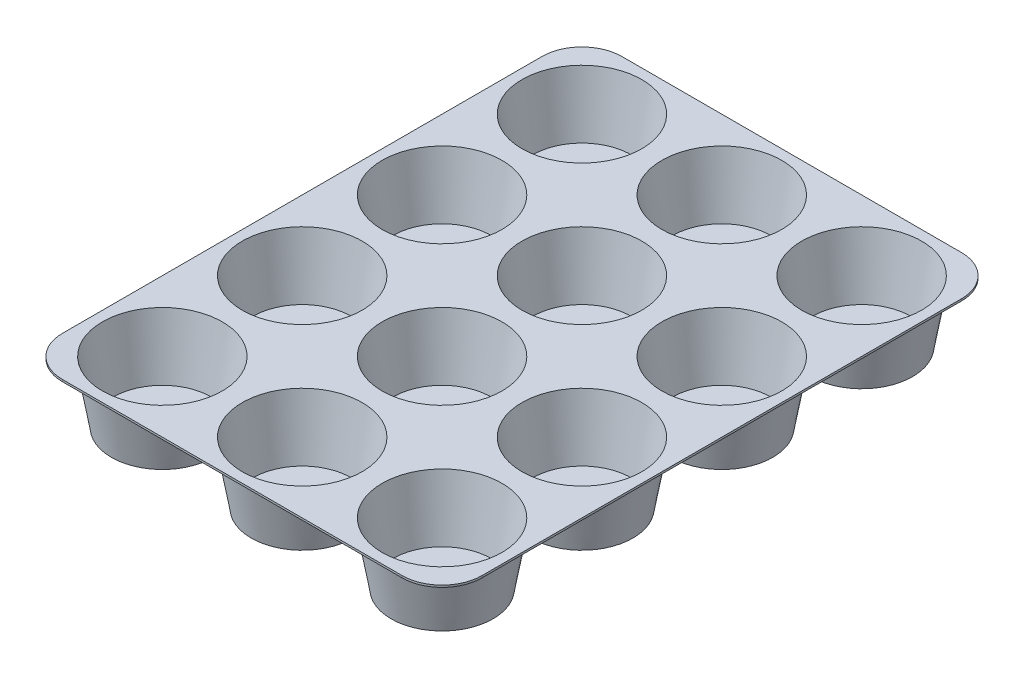
from build123d import *

# Parameters (mm, degrees)
SKETCH1_W                  = 266.7
SKETCH1_H                  = 355.6
BOSS_EXTRUDE1_DEPTH        = 1.27
SKETCH2_R                  = 39.37
BOSS_EXTRUDE2_DEPTH        = 39.37
BOSS_EXTRUDE2_DRAFT        = -10
SKETCH3_R                  = 38.1
CUT_EXTRUDE1_DEPTH         = 38.1
CUT_EXTRUDE1_DRAFT         = -10
LPATTERN1_COPY_1_SKETCH_R  = 39.37
LPATTERN1_COPY_1_DEPTH     = 39.37
LPATTERN1_COPY_1_DRAFT     = -10
LPATTERN1_COPY_2_SKETCH_R  = 39.37
LPATTERN1_COPY_2_DEPTH     = 39.37
LPATTERN1_COPY_2_DRAFT     = -10
LPATTERN1_COPY_3_SKETCH_R  = 39.37
LPATTERN1_COPY_3_DEPTH     = 39.37
LPATTERN1_COPY_3_DRAFT     = -10
LPATTERN1_COPY_4_SKETCH_R  = 39.37
LPATTERN1_COPY_4_DEPTH     = 39.37
LPATTERN1_COPY_4_DRAFT     = -10
LPATTERN1_COPY_5_SKETCH_R  = 39.37
LPATTERN1_COPY_5_DEPTH     = 39.37
LPATTERN1_COPY_5_DRAFT     = -10
LPATTERN1_COPY_6_SKETCH_R  = 39.37
LPATTERN1_COPY_6_DEPTH     = 39.37
LPATTERN1_COPY_6_DRAFT     = -10
LPATTERN1_COPY_7_SKETCH_R  = 39.37
LPATTERN1_COPY_7_DEPTH     = 39.37
LPATTERN1_COPY_7_DRAFT     = -10
LPATTERN1_COPY_8_SKETCH_R  = 39.37
LPATTERN1_COPY_8_DEPTH     = 39.37
LPATTERN1_COPY_8_DRAFT     = -10
LPATTERN1_COPY_9_SKETCH_R  = 39.37
LPATTERN1_COPY_9_DEPTH     = 39.37
LPATTERN1_COPY_9_DRAFT     = -10
LPATTERN1_COPY_10_SKETCH_R = 39.37
LPATTERN1_COPY_10_DEPTH    = 39.37
LPATTERN1_COPY_10_DRAFT    = -10
LPATTERN1_COPY_11_SKETCH_R = 39.37
LPATTERN1_COPY_11_DEPTH    = 39.37
LPATTERN1_COPY_11_DRAFT    = -10
LPATTERN1_COPY_12_SKETCH_R = 38.1
LPATTERN1_COPY_12_DEPTH    = 38.1
LPATTERN1_COPY_12_DRAFT    = -10
LPATTERN1_COPY_13_SKETCH_R = 38.1
LPATTERN1_COPY_13_DEPTH    = 38.1
LPATTERN1_COPY_13_DRAFT    = -10
LPATTERN1_COPY_14_SKETCH_R = 38.1
LPATTERN1_COPY_14_DEPTH    = 38.1
LPATTERN1_COPY_14_DRAFT    = -10
LPATTERN1_COPY_15_SKETCH_R = 38.1
LPATTERN1_COPY_15_DEPTH    = 38.1
LPATTERN1_COPY_15_DRAFT    = -10
LPATTERN1_COPY_16_SKETCH_R = 38.1
LPATTERN1_COPY_16_DEPTH    = 38.1
LPATTERN1_COPY_16_DRAFT    = -10
LPATTERN1_COPY_17_SKETCH_R = 38.1
LPATTERN1_COPY_17_DEPTH    = 38.1
LPATTERN1_COPY_17_DRAFT    = -10
LPATTERN1_COPY_18_SKETCH_R = 38.1
LPATTERN1_COPY_18_DEPTH    = 38.1
LPATTERN1_COPY_18_DRAFT    = -10
LPATTERN1_COPY_19_SKETCH_R = 38.1
LPATTERN1_COPY_19_DEPTH    = 38.1
LPATTERN1_COPY_19_DRAFT    = -10
LPATTERN1_COPY_20_SKETCH_R = 38.1
LPATTERN1_COPY_20_DEPTH    = 38.1
LPATTERN1_COPY_20_DRAFT    = -10
LPATTERN1_COPY_21_SKETCH_R = 38.1
LPATTERN1_COPY_21_DEPTH    = 38.1
LPATTERN1_COPY_21_DRAFT    = -10
LPATTERN1_COPY_22_SKETCH_R = 38.1
LPATTERN1_COPY_22_DEPTH    = 38.1
LPATTERN1_COPY_22_DRAFT    = -10
FILLET1_R                  = 25.4


with BuildPart() as part:
    # Sketch1 → Boss-Extrude1 (new body)
    with BuildSketch(Plane(origin=(0, 0, 0), x_dir=(1, 0, 0), z_dir=(0, 1, 0))):
        Rectangle(SKETCH1_W, SKETCH1_H)
    extrude(amount=BOSS_EXTRUDE1_DEPTH)


with BuildPart() as boss_extrude2_tool:
    # Sketch2 → Boss-Extrude2 (with draft: the straight prism first)
    with BuildSketch(Plane(origin=(0, 1.27, 0), x_dir=(1, 0, 0), z_dir=(0, 1, 0))):
        with Locations((-88.9, 133.35)):
            Circle(SKETCH2_R)
    extrude(amount=-BOSS_EXTRUDE2_DEPTH)
    # Boss-Extrude2: the draft: its side faces are tilted about the plane it starts from
    boss_extrude2_sides = [boss_extrude2_tool.faces().sort_by_distance(p)[0] for p in [
        (-128.27, -18.415, -133.35),
    ]]
    draft(boss_extrude2_sides, Plane(origin=(0, 1.27, 0), x_dir=(1, 0, 0), z_dir=(0, 1, 0)), BOSS_EXTRUDE2_DRAFT)


with BuildPart() as part_1:
    add(part.part)

    # Boss-Extrude2: add boss_extrude2_tool
    add(boss_extrude2_tool.part)


with BuildPart() as cut_extrude1_tool:
    # Sketch3 → Cut-Extrude1 (with draft: the straight prism first)
    with BuildSketch(Plane(origin=(0, 1.27, 0), x_dir=(1, 0, 0), z_dir=(0, 1, 0))):
        with Locations((-88.9, 133.35)):
            Circle(SKETCH3_R)
    extrude(amount=-CUT_EXTRUDE1_DEPTH)
    # Cut-Extrude1: the draft: its side faces are tilted about the plane it starts from
    cut_extrude1_sides = [cut_extrude1_tool.faces().sort_by_distance(p)[0] for p in [
        (-127, -17.78, -133.35),
    ]]
    draft(cut_extrude1_sides, Plane(origin=(0, 1.27, 0), x_dir=(1, 0, 0), z_dir=(0, 1, 0)), CUT_EXTRUDE1_DRAFT)


with BuildPart() as part_2:
    add(part_1.part)

    # Cut-Extrude1: cut by cut_extrude1_tool
    add(cut_extrude1_tool.part, mode=Mode.SUBTRACT)


with BuildPart() as lpattern1_copy_1_tool:
    # LPattern1 copy 1 sketch → LPattern1 copy 1 (with draft: the straight prism first)
    with BuildSketch(Plane(origin=(0, 1.27, 88.9), x_dir=(1, 0, 0), z_dir=(0, 1, 0))):
        with Locations((-88.9, 133.35)):
            Circle(LPATTERN1_COPY_1_SKETCH_R)
    extrude(amount=-LPATTERN1_COPY_1_DEPTH)
    # LPattern1 copy 1: the draft: its side faces are tilted about the plane it starts from
    lpattern1_copy_1_sides = [lpattern1_copy_1_tool.faces().sort_by_distance(p)[0] for p in [
        (-128.27, -18.415, -44.45),
    ]]
    draft(lpattern1_copy_1_sides, Plane(origin=(0, 1.27, 88.9), x_dir=(1, 0, 0), z_dir=(0, 1, 0)), LPATTERN1_COPY_1_DRAFT)


with BuildPart() as part_3:
    add(part_2.part)

    # LPattern1 copy 1: add lpattern1_copy_1_tool
    add(lpattern1_copy_1_tool.part)


with BuildPart() as lpattern1_copy_2_tool:
    # LPattern1 copy 2 sketch → LPattern1 copy 2 (with draft: the straight prism first)
    with BuildSketch(Plane(origin=(0, 1.27, 177.8), x_dir=(1, 0, 0), z_dir=(0, 1, 0))):
        with Locations((-88.9, 133.35)):
            Circle(LPATTERN1_COPY_2_SKETCH_R)
    extrude(amount=-LPATTERN1_COPY_2_DEPTH)
    # LPattern1 copy 2: the draft: its side faces are tilted about the plane it starts from
    lpattern1_copy_2_sides = [lpattern1_copy_2_tool.faces().sort_by_distance(p)[0] for p in [
        (-128.27, -18.415, 44.45),
    ]]
    draft(lpattern1_copy_2_sides, Plane(origin=(0, 1.27, 177.8), x_dir=(1, 0, 0), z_dir=(0, 1, 0)), LPATTERN1_COPY_2_DRAFT)


with BuildPart() as part_4:
    add(part_3.part)

    # LPattern1 copy 2: add lpattern1_copy_2_tool
    add(lpattern1_copy_2_tool.part)


with BuildPart() as lpattern1_copy_3_tool:
    # LPattern1 copy 3 sketch → LPattern1 copy 3 (with draft: the straight prism first)
    with BuildSketch(Plane(origin=(0, 1.27, 266.7), x_dir=(1, 0, 0), z_dir=(0, 1, 0))):
        with Locations((-88.9, 133.35)):
            Circle(LPATTERN1_COPY_3_SKETCH_R)
    extrude(amount=-LPATTERN1_COPY_3_DEPTH)
    # LPattern1 copy 3: the draft: its side faces are tilted about the plane it starts from
    lpattern1_copy_3_sides = [lpattern1_copy_3_tool.faces().sort_by_distance(p)[0] for p in [
        (-128.27, -18.415, 133.35),
    ]]
    draft(lpattern1_copy_3_sides, Plane(origin=(0, 1.27, 266.7), x_dir=(1, 0, 0), z_dir=(0, 1, 0)), LPATTERN1_COPY_3_DRAFT)


with BuildPart() as part_5:
    add(part_4.part)

    # LPattern1 copy 3: add lpattern1_copy_3_tool
    add(lpattern1_copy_3_tool.part)


with BuildPart() as lpattern1_copy_4_tool:
    # LPattern1 copy 4 sketch → LPattern1 copy 4 (with draft: the straight prism first)
    with BuildSketch(Plane(origin=(88.9, 1.27, 0), x_dir=(1, 0, 0), z_dir=(0, 1, 0))):
        with Locations((-88.9, 133.35)):
            Circle(LPATTERN1_COPY_4_SKETCH_R)
    extrude(amount=-LPATTERN1_COPY_4_DEPTH)
    # LPattern1 copy 4: the draft: its side faces are tilted about the plane it starts from
    lpattern1_copy_4_sides = [lpattern1_copy_4_tool.faces().sort_by_distance(p)[0] for p in [
        (-39.37, -18.415, -133.35),
    ]]
    draft(lpattern1_copy_4_sides, Plane(origin=(88.9, 1.27, 0), x_dir=(1, 0, 0), z_dir=(0, 1, 0)), LPATTERN1_COPY_4_DRAFT)


with BuildPart() as part_6:
    add(part_5.part)

    # LPattern1 copy 4: add lpattern1_copy_4_tool
    add(lpattern1_copy_4_tool.part)


with BuildPart() as lpattern1_copy_5_tool:
    # LPattern1 copy 5 sketch → LPattern1 copy 5 (with draft: the straight prism first)
    with BuildSketch(Plane(origin=(88.9, 1.27, 88.9), x_dir=(1, 0, 0), z_dir=(0, 1, 0))):
        with Locations((-88.9, 133.35)):
            Circle(LPATTERN1_COPY_5_SKETCH_R)
    extrude(amount=-LPATTERN1_COPY_5_DEPTH)
    # LPattern1 copy 5: the draft: its side faces are tilted about the plane it starts from
    lpattern1_copy_5_sides = [lpattern1_copy_5_tool.faces().sort_by_distance(p)[0] for p in [
        (-39.37, -18.415, -44.45),
    ]]
    draft(lpattern1_copy_5_sides, Plane(origin=(88.9, 1.27, 88.9), x_dir=(1, 0, 0), z_dir=(0, 1, 0)), LPATTERN1_COPY_5_DRAFT)


with BuildPart() as part_7:
    add(part_6.part)

    # LPattern1 copy 5: add lpattern1_copy_5_tool
    add(lpattern1_copy_5_tool.part)


with BuildPart() as lpattern1_copy_6_tool:
    # LPattern1 copy 6 sketch → LPattern1 copy 6 (with draft: the straight prism first)
    with BuildSketch(Plane(origin=(88.9, 1.27, 177.8), x_dir=(1, 0, 0), z_dir=(0, 1, 0))):
        with Locations((-88.9, 133.35)):
            Circle(LPATTERN1_COPY_6_SKETCH_R)
    extrude(amount=-LPATTERN1_COPY_6_DEPTH)
    # LPattern1 copy 6: the draft: its side faces are tilted about the plane it starts from
    lpattern1_copy_6_sides = [lpattern1_copy_6_tool.faces().sort_by_distance(p)[0] for p in [
        (-39.37, -18.415, 44.45),
    ]]
    draft(lpattern1_copy_6_sides, Plane(origin=(88.9, 1.27, 177.8), x_dir=(1, 0, 0), z_dir=(0, 1, 0)), LPATTERN1_COPY_6_DRAFT)


with BuildPart() as part_8:
    add(part_7.part)

    # LPattern1 copy 6: add lpattern1_copy_6_tool
    add(lpattern1_copy_6_tool.part)


with BuildPart() as lpattern1_copy_7_tool:
    # LPattern1 copy 7 sketch → LPattern1 copy 7 (with draft: the straight prism first)
    with BuildSketch(Plane(origin=(88.9, 1.27, 266.7), x_dir=(1, 0, 0), z_dir=(0, 1, 0))):
        with Locations((-88.9, 133.35)):
            Circle(LPATTERN1_COPY_7_SKETCH_R)
    extrude(amount=-LPATTERN1_COPY_7_DEPTH)
    # LPattern1 copy 7: the draft: its side faces are tilted about the plane it starts from
    lpattern1_copy_7_sides = [lpattern1_copy_7_tool.faces().sort_by_distance(p)[0] for p in [
        (-39.37, -18.415, 133.35),
    ]]
    draft(lpattern1_copy_7_sides, Plane(origin=(88.9, 1.27, 266.7), x_dir=(1, 0, 0), z_dir=(0, 1, 0)), LPATTERN1_COPY_7_DRAFT)


with BuildPart() as part_9:
    add(part_8.part)

    # LPattern1 copy 7: add lpattern1_copy_7_tool
    add(lpattern1_copy_7_tool.part)


with BuildPart() as lpattern1_copy_8_tool:
    # LPattern1 copy 8 sketch → LPattern1 copy 8 (with draft: the straight prism first)
    with BuildSketch(Plane(origin=(177.8, 1.27, 0), x_dir=(1, 0, 0), z_dir=(0, 1, 0))):
        with Locations((-88.9, 133.35)):
            Circle(LPATTERN1_COPY_8_SKETCH_R)
    extrude(amount=-LPATTERN1_COPY_8_DEPTH)
    # LPattern1 copy 8: the draft: its side faces are tilted about the plane it starts from
    lpattern1_copy_8_sides = [lpattern1_copy_8_tool.faces().sort_by_distance(p)[0] for p in [
        (49.53, -18.415, -133.35),
    ]]
    draft(lpattern1_copy_8_sides, Plane(origin=(177.8, 1.27, 0), x_dir=(1, 0, 0), z_dir=(0, 1, 0)), LPATTERN1_COPY_8_DRAFT)


with BuildPart() as part_10:
    add(part_9.part)

    # LPattern1 copy 8: add lpattern1_copy_8_tool
    add(lpattern1_copy_8_tool.part)


with BuildPart() as lpattern1_copy_9_tool:
    # LPattern1 copy 9 sketch → LPattern1 copy 9 (with draft: the straight prism first)
    with BuildSketch(Plane(origin=(177.8, 1.27, 88.9), x_dir=(1, 0, 0), z_dir=(0, 1, 0))):
        with Locations((-88.9, 133.35)):
            Circle(LPATTERN1_COPY_9_SKETCH_R)
    extrude(amount=-LPATTERN1_COPY_9_DEPTH)
    # LPattern1 copy 9: the draft: its side faces are tilted about the plane it starts from
    lpattern1_copy_9_sides = [lpattern1_copy_9_tool.faces().sort_by_distance(p)[0] for p in [
        (49.53, -18.415, -44.45),
    ]]
    draft(lpattern1_copy_9_sides, Plane(origin=(177.8, 1.27, 88.9), x_dir=(1, 0, 0), z_dir=(0, 1, 0)), LPATTERN1_COPY_9_DRAFT)


with BuildPart() as part_11:
    add(part_10.part)

    # LPattern1 copy 9: add lpattern1_copy_9_tool
    add(lpattern1_copy_9_tool.part)


with BuildPart() as lpattern1_copy_10_tool:
    # LPattern1 copy 10 sketch → LPattern1 copy 10 (with draft: the straight prism first)
    with BuildSketch(Plane(origin=(177.8, 1.27, 177.8), x_dir=(1, 0, 0), z_dir=(0, 1, 0))):
        with Locations((-88.9, 133.35)):
            Circle(LPATTERN1_COPY_10_SKETCH_R)
    extrude(amount=-LPATTERN1_COPY_10_DEPTH)
    # LPattern1 copy 10: the draft: its side faces are tilted about the plane it starts from
    lpattern1_copy_10_sides = [lpattern1_copy_10_tool.faces().sort_by_distance(p)[0] for p in [
        (49.53, -18.415, 44.45),
    ]]
    draft(lpattern1_copy_10_sides, Plane(origin=(177.8, 1.27, 177.8), x_dir=(1, 0, 0), z_dir=(0, 1, 0)), LPATTERN1_COPY_10_DRAFT)


with BuildPart() as part_12:
    add(part_11.part)

    # LPattern1 copy 10: add lpattern1_copy_10_tool
    add(lpattern1_copy_10_tool.part)


with BuildPart() as lpattern1_copy_11_tool:
    # LPattern1 copy 11 sketch → LPattern1 copy 11 (with draft: the straight prism first)
    with BuildSketch(Plane(origin=(177.8, 1.27, 266.7), x_dir=(1, 0, 0), z_dir=(0, 1, 0))):
        with Locations((-88.9, 133.35)):
            Circle(LPATTERN1_COPY_11_SKETCH_R)
    extrude(amount=-LPATTERN1_COPY_11_DEPTH)
    # LPattern1 copy 11: the draft: its side faces are tilted about the plane it starts from
    lpattern1_copy_11_sides = [lpattern1_copy_11_tool.faces().sort_by_distance(p)[0] for p in [
        (49.53, -18.415, 133.35),
    ]]
    draft(lpattern1_copy_11_sides, Plane(origin=(177.8, 1.27, 266.7), x_dir=(1, 0, 0), z_dir=(0, 1, 0)), LPATTERN1_COPY_11_DRAFT)


with BuildPart() as part_13:
    add(part_12.part)

    # LPattern1 copy 11: add lpattern1_copy_11_tool
    add(lpattern1_copy_11_tool.part)


with BuildPart() as lpattern1_copy_12_tool:
    # LPattern1 copy 12 sketch → LPattern1 copy 12 (with draft: the straight prism first)
    with BuildSketch(Plane(origin=(0, 1.27, 88.9), x_dir=(1, 0, 0), z_dir=(0, 1, 0))):
        with Locations((-88.9, 133.35)):
            Circle(LPATTERN1_COPY_12_SKETCH_R)
    extrude(amount=-LPATTERN1_COPY_12_DEPTH)
    # LPattern1 copy 12: the draft: its side faces are tilted about the plane it starts from
    lpattern1_copy_12_sides = [lpattern1_copy_12_tool.faces().sort_by_distance(p)[0] for p in [
        (-127, -17.78, -44.45),
    ]]
    draft(lpattern1_copy_12_sides, Plane(origin=(0, 1.27, 88.9), x_dir=(1, 0, 0), z_dir=(0, 1, 0)), LPATTERN1_COPY_12_DRAFT)


with BuildPart() as part_14:
    add(part_13.part)

    # LPattern1 copy 12: cut by lpattern1_copy_12_tool
    add(lpattern1_copy_12_tool.part, mode=Mode.SUBTRACT)


with BuildPart() as lpattern1_copy_13_tool:
    # LPattern1 copy 13 sketch → LPattern1 copy 13 (with draft: the straight prism first)
    with BuildSketch(Plane(origin=(0, 1.27, 177.8), x_dir=(1, 0, 0), z_dir=(0, 1, 0))):
        with Locations((-88.9, 133.35)):
            Circle(LPATTERN1_COPY_13_SKETCH_R)
    extrude(amount=-LPATTERN1_COPY_13_DEPTH)
    # LPattern1 copy 13: the draft: its side faces are tilted about the plane it starts from
    lpattern1_copy_13_sides = [lpattern1_copy_13_tool.faces().sort_by_distance(p)[0] for p in [
        (-127, -17.78, 44.45),
    ]]
    draft(lpattern1_copy_13_sides, Plane(origin=(0, 1.27, 177.8), x_dir=(1, 0, 0), z_dir=(0, 1, 0)), LPATTERN1_COPY_13_DRAFT)


with BuildPart() as part_15:
    add(part_14.part)

    # LPattern1 copy 13: cut by lpattern1_copy_13_tool
    add(lpattern1_copy_13_tool.part, mode=Mode.SUBTRACT)


with BuildPart() as lpattern1_copy_14_tool:
    # LPattern1 copy 14 sketch → LPattern1 copy 14 (with draft: the straight prism first)
    with BuildSketch(Plane(origin=(0, 1.27, 266.7), x_dir=(1, 0, 0), z_dir=(0, 1, 0))):
        with Locations((-88.9, 133.35)):
            Circle(LPATTERN1_COPY_14_SKETCH_R)
    extrude(amount=-LPATTERN1_COPY_14_DEPTH)
    # LPattern1 copy 14: the draft: its side faces are tilted about the plane it starts from
    lpattern1_copy_14_sides = [lpattern1_copy_14_tool.faces().sort_by_distance(p)[0] for p in [
        (-127, -17.78, 133.35),
    ]]
    draft(lpattern1_copy_14_sides, Plane(origin=(0, 1.27, 266.7), x_dir=(1, 0, 0), z_dir=(0, 1, 0)), LPATTERN1_COPY_14_DRAFT)


with BuildPart() as part_16:
    add(part_15.part)

    # LPattern1 copy 14: cut by lpattern1_copy_14_tool
    add(lpattern1_copy_14_tool.part, mode=Mode.SUBTRACT)


with BuildPart() as lpattern1_copy_15_tool:
    # LPattern1 copy 15 sketch → LPattern1 copy 15 (with draft: the straight prism first)
    with BuildSketch(Plane(origin=(88.9, 1.27, 0), x_dir=(1, 0, 0), z_dir=(0, 1, 0))):
        with Locations((-88.9, 133.35)):
            Circle(LPATTERN1_COPY_15_SKETCH_R)
    extrude(amount=-LPATTERN1_COPY_15_DEPTH)
    # LPattern1 copy 15: the draft: its side faces are tilted about the plane it starts from
    lpattern1_copy_15_sides = [lpattern1_copy_15_tool.faces().sort_by_distance(p)[0] for p in [
        (-38.1, -17.78, -133.35),
    ]]
    draft(lpattern1_copy_15_sides, Plane(origin=(88.9, 1.27, 0), x_dir=(1, 0, 0), z_dir=(0, 1, 0)), LPATTERN1_COPY_15_DRAFT)


with BuildPart() as part_17:
    add(part_16.part)

    # LPattern1 copy 15: cut by lpattern1_copy_15_tool
    add(lpattern1_copy_15_tool.part, mode=Mode.SUBTRACT)


with BuildPart() as lpattern1_copy_16_tool:
    # LPattern1 copy 16 sketch → LPattern1 copy 16 (with draft: the straight prism first)
    with BuildSketch(Plane(origin=(88.9, 1.27, 88.9), x_dir=(1, 0, 0), z_dir=(0, 1, 0))):
        with Locations((-88.9, 133.35)):
            Circle(LPATTERN1_COPY_16_SKETCH_R)
    extrude(amount=-LPATTERN1_COPY_16_DEPTH)
    # LPattern1 copy 16: the draft: its side faces are tilted about the plane it starts from
    lpattern1_copy_16_sides = [lpattern1_copy_16_tool.faces().sort_by_distance(p)[0] for p in [
        (-38.1, -17.78, -44.45),
    ]]
    draft(lpattern1_copy_16_sides, Plane(origin=(88.9, 1.27, 88.9), x_dir=(1, 0, 0), z_dir=(0, 1, 0)), LPATTERN1_COPY_16_DRAFT)


with BuildPart() as part_18:
    add(part_17.part)

    # LPattern1 copy 16: cut by lpattern1_copy_16_tool
    add(lpattern1_copy_16_tool.part, mode=Mode.SUBTRACT)


with BuildPart() as lpattern1_copy_17_tool:
    # LPattern1 copy 17 sketch → LPattern1 copy 17 (with draft: the straight prism first)
    with BuildSketch(Plane(origin=(88.9, 1.27, 177.8), x_dir=(1, 0, 0), z_dir=(0, 1, 0))):
        with Locations((-88.9, 133.35)):
            Circle(LPATTERN1_COPY_17_SKETCH_R)
    extrude(amount=-LPATTERN1_COPY_17_DEPTH)
    # LPattern1 copy 17: the draft: its side faces are tilted about the plane it starts from
    lpattern1_copy_17_sides = [lpattern1_copy_17_tool.faces().sort_by_distance(p)[0] for p in [
        (-38.1, -17.78, 44.45),
    ]]
    draft(lpattern1_copy_17_sides, Plane(origin=(88.9, 1.27, 177.8), x_dir=(1, 0, 0), z_dir=(0, 1, 0)), LPATTERN1_COPY_17_DRAFT)


with BuildPart() as part_19:
    add(part_18.part)

    # LPattern1 copy 17: cut by lpattern1_copy_17_tool
    add(lpattern1_copy_17_tool.part, mode=Mode.SUBTRACT)


with BuildPart() as lpattern1_copy_18_tool:
    # LPattern1 copy 18 sketch → LPattern1 copy 18 (with draft: the straight prism first)
    with BuildSketch(Plane(origin=(88.9, 1.27, 266.7), x_dir=(1, 0, 0), z_dir=(0, 1, 0))):
        with Locations((-88.9, 133.35)):
            Circle(LPATTERN1_COPY_18_SKETCH_R)
    extrude(amount=-LPATTERN1_COPY_18_DEPTH)
    # LPattern1 copy 18: the draft: its side faces are tilted about the plane it starts from
    lpattern1_copy_18_sides = [lpattern1_copy_18_tool.faces().sort_by_distance(p)[0] for p in [
        (-38.1, -17.78, 133.35),
    ]]
    draft(lpattern1_copy_18_sides, Plane(origin=(88.9, 1.27, 266.7), x_dir=(1, 0, 0), z_dir=(0, 1, 0)), LPATTERN1_COPY_18_DRAFT)


with BuildPart() as part_20:
    add(part_19.part)

    # LPattern1 copy 18: cut by lpattern1_copy_18_tool
    add(lpattern1_copy_18_tool.part, mode=Mode.SUBTRACT)


with BuildPart() as lpattern1_copy_19_tool:
    # LPattern1 copy 19 sketch → LPattern1 copy 19 (with draft: the straight prism first)
    with BuildSketch(Plane(origin=(177.8, 1.27, 0), x_dir=(1, 0, 0), z_dir=(0, 1, 0))):
        with Locations((-88.9, 133.35)):
            Circle(LPATTERN1_COPY_19_SKETCH_R)
    extrude(amount=-LPATTERN1_COPY_19_DEPTH)
    # LPattern1 copy 19: the draft: its side faces are tilted about the plane it starts from
    lpattern1_copy_19_sides = [lpattern1_copy_19_tool.faces().sort_by_distance(p)[0] for p in [
        (50.8, -17.78, -133.35),
    ]]
    draft(lpattern1_copy_19_sides, Plane(origin=(177.8, 1.27, 0), x_dir=(1, 0, 0), z_dir=(0, 1, 0)), LPATTERN1_COPY_19_DRAFT)


with BuildPart() as part_21:
    add(part_20.part)

    # LPattern1 copy 19: cut by lpattern1_copy_19_tool
    add(lpattern1_copy_19_tool.part, mode=Mode.SUBTRACT)


with BuildPart() as lpattern1_copy_20_tool:
    # LPattern1 copy 20 sketch → LPattern1 copy 20 (with draft: the straight prism first)
    with BuildSketch(Plane(origin=(177.8, 1.27, 88.9), x_dir=(1, 0, 0), z_dir=(0, 1, 0))):
        with Locations((-88.9, 133.35)):
            Circle(LPATTERN1_COPY_20_SKETCH_R)
    extrude(amount=-LPATTERN1_COPY_20_DEPTH)
    # LPattern1 copy 20: the draft: its side faces are tilted about the plane it starts from
    lpattern1_copy_20_sides = [lpattern1_copy_20_tool.faces().sort_by_distance(p)[0] for p in [
        (50.8, -17.78, -44.45),
    ]]
    draft(lpattern1_copy_20_sides, Plane(origin=(177.8, 1.27, 88.9), x_dir=(1, 0, 0), z_dir=(0, 1, 0)), LPATTERN1_COPY_20_DRAFT)


with BuildPart() as part_22:
    add(part_21.part)

    # LPattern1 copy 20: cut by lpattern1_copy_20_tool
    add(lpattern1_copy_20_tool.part, mode=Mode.SUBTRACT)


with BuildPart() as lpattern1_copy_21_tool:
    # LPattern1 copy 21 sketch → LPattern1 copy 21 (with draft: the straight prism first)
    with BuildSketch(Plane(origin=(177.8, 1.27, 177.8), x_dir=(1, 0, 0), z_dir=(0, 1, 0))):
        with Locations((-88.9, 133.35)):
            Circle(LPATTERN1_COPY_21_SKETCH_R)
    extrude(amount=-LPATTERN1_COPY_21_DEPTH)
    # LPattern1 copy 21: the draft: its side faces are tilted about the plane it starts from
    lpattern1_copy_21_sides = [lpattern1_copy_21_tool.faces().sort_by_distance(p)[0] for p in [
        (50.8, -17.78, 44.45),
    ]]
    draft(lpattern1_copy_21_sides, Plane(origin=(177.8, 1.27, 177.8), x_dir=(1, 0, 0), z_dir=(0, 1, 0)), LPATTERN1_COPY_21_DRAFT)


with BuildPart() as part_23:
    add(part_22.part)

    # LPattern1 copy 21: cut by lpattern1_copy_21_tool
    add(lpattern1_copy_21_tool.part, mode=Mode.SUBTRACT)


with BuildPart() as lpattern1_copy_22_tool:
    # LPattern1 copy 22 sketch → LPattern1 copy 22 (with draft: the straight prism first)
    with BuildSketch(Plane(origin=(177.8, 1.27, 266.7), x_dir=(1, 0, 0), z_dir=(0, 1, 0))):
        with Locations((-88.9, 133.35)):
            Circle(LPATTERN1_COPY_22_SKETCH_R)
    extrude(amount=-LPATTERN1_COPY_22_DEPTH)
    # LPattern1 copy 22: the draft: its side faces are tilted about the plane it starts from
    lpattern1_copy_22_sides = [lpattern1_copy_22_tool.faces().sort_by_distance(p)[0] for p in [
        (50.8, -17.78, 133.35),
    ]]
    draft(lpattern1_copy_22_sides, Plane(origin=(177.8, 1.27, 266.7), x_dir=(1, 0, 0), z_dir=(0, 1, 0)), LPATTERN1_COPY_22_DRAFT)


with BuildPart() as part_24:
    add(part_23.part)

    # LPattern1 copy 22: cut by lpattern1_copy_22_tool
    add(lpattern1_copy_22_tool.part, mode=Mode.SUBTRACT)

    # Fillet1
    fillet1_edges = [part_24.edges().sort_by_distance(p)[0] for p in [
        (133.35, 0.635, 177.8),
        (-133.35, 0.635, 177.8),
        (-133.35, 0.635, -177.8),
        (133.35, 0.635, -177.8),
    ]]
    fillet(fillet1_edges, radius=FILLET1_R)


solid = part_24.part
